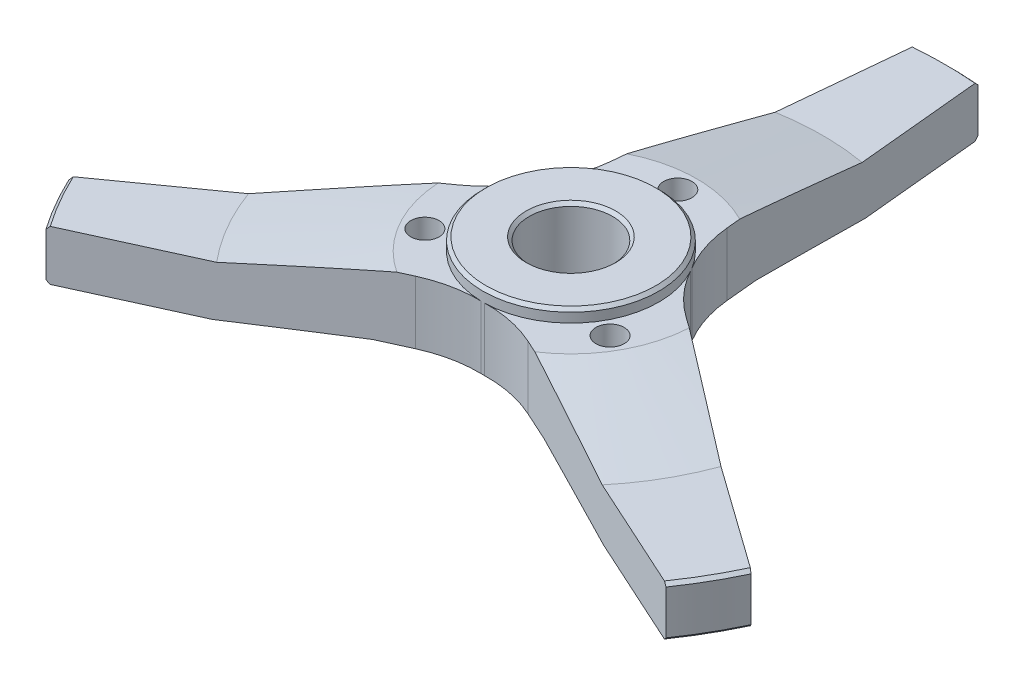
from build123d import *

# Parameters (mm, degrees)
SKETCH_4_OUTSIDE_W        = 310.112
SKETCH_4_OUTSIDE_H        = 310.112
CUT_EXTRUDE_1_DEPTH       = 28
HOLE_WIZARD_1_D           = 9
HOLE_WIZARD_1_CBORE_D     = 15
HOLE_WIZARD_1_CBORE_DEPTH = 9
HOLE_WIZARD_M30_2_D       = 26.5
CHAMFER_1_SIZE            = 1


with BuildPart() as part:
    # 草图3 → 旋转1 (revolve)
    with BuildSketch(Plane.XY, mode=Mode.PRIVATE) as revolve_1_sk:
        Polygon((0, 0), (-28, 0), (-28, -4), (-40, -4), (-80, -12), (-120, -12), (-120, -28), (-81, -28), (-45, -24), (0, -24), align=None)
    revolve(revolve_1_sk.sketch.rotate(Axis((0, 0, 0), (0, -1, 0)), 270), axis=Axis((0, 0, 0), (0, -1, 0)))

    # 草图4 outside → 切除-拉伸1 (cut)
    with BuildSketch(Plane(origin=(0, 0, 0), x_dir=(1, 0, 0), z_dir=(0, 1, 0))):
        Rectangle(SKETCH_4_OUTSIDE_W, SKETCH_4_OUTSIDE_H)
        with BuildLine():
            Line((-18.406763831, 31.296320472), (-9.905, 119.590513733))
            ThreePointArc((-9.905, 119.590513733), (0, 120), (9.905, 119.590513733))
            Line((9.905, 119.590513733), (18.406763831, 31.296320472))
            ThreePointArc((18.406763831, 31.296320472), (20.246227355, 22.568533354), (23.974016609, 14.465356118))
            ThreePointArc((23.974016609, 14.465356118), (24.248711306, 14), (24.514374178, 13.529429355))
            ThreePointArc((24.514374178, 13.529429355), (29.668036888, 6.249480544), (36.306790489, 0.292564843))
            Line((36.306790489, 0.292564843), (108.520922945, -51.217275242))
            ThreePointArc((108.520922945, -51.217275242), (103.923048454, -60), (98.615922945, -68.373238491))
            Line((98.615922945, -68.373238491), (17.900026658, -31.588885314))
            ThreePointArc((17.900026658, -31.588885314), (9.421809533, -28.818013897), (0.540357568, -27.994785473))
            ThreePointArc((0.540357568, -27.994785473), (0, -28), (-0.540357568, -27.994785473))
            ThreePointArc((-0.540357568, -27.994785473), (-9.421809533, -28.818013897), (-17.900026658, -31.588885314))
            Line((-17.900026658, -31.588885314), (-98.615922945, -68.373238491))
            ThreePointArc((-98.615922945, -68.373238491), (-103.923048454, -60), (-108.520922945, -51.217275242))
            Line((-108.520922945, -51.217275242), (-36.306790489, 0.292564843))
            ThreePointArc((-36.306790489, 0.292564843), (-29.668036888, 6.249480544), (-24.514374178, 13.529429355))
            ThreePointArc((-24.514374178, 13.529429355), (-24.248711306, 14), (-23.974016609, 14.465356118))
            ThreePointArc((-23.974016609, 14.465356118), (-20.246227355, 22.568533354), (-18.406763831, 31.296320472))
        make_face(mode=Mode.SUBTRACT)
    extrude(amount=-CUT_EXTRUDE_1_DEPTH, mode=Mode.SUBTRACT)

    # 打孔尺寸(%根据)内六角圆柱头螺钉的类型1 (through all)
    with Locations(Plane(origin=(0, -24, -34), x_dir=(0, 0, -1), z_dir=(0, -1, 0))):
        with Locations((0, 0), (-51, 29.444863729), (-51, -29.444863729)):
            CounterBoreHole(HOLE_WIZARD_1_D / 2, HOLE_WIZARD_1_CBORE_D / 2, HOLE_WIZARD_1_CBORE_DEPTH)

    # M30 螺纹孔2 (through all)
    with Locations(Plane.ZX):
        with Locations((0, 0)):
            Hole(HOLE_WIZARD_M30_2_D / 2)

    # 倒角1
    chamfer_1_edges = [part.edges().sort_by_distance(p)[0] for p in [
        (-0.270191364, 0, 27.998696338),
        (0, 0, 13.25),
        (0, -24, 13.25),
        (0, -28, -120),
        (-103.923048454, -28, 60),
        (0, -12, -120),
        (-103.923048454, -12, 60),
        (103.923048454, -28, 60),
        (103.923048454, -12, 60),
    ]]
    chamfer(chamfer_1_edges, length=CHAMFER_1_SIZE)


solid = part.part
